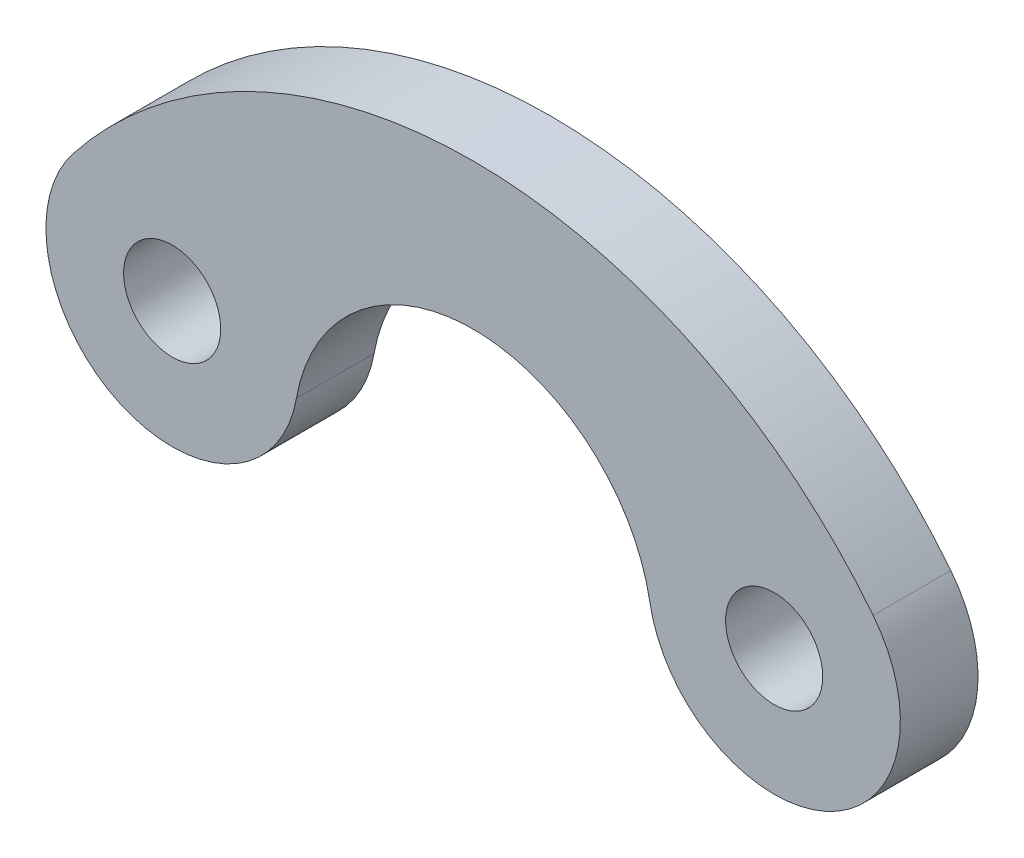
from build123d import *

# Parameters (mm, degrees)
SKETCH1_R           = 1.27
BOSS_EXTRUDE1_DEPTH = 2.032


with BuildPart() as part:
    # Sketch1 → Boss-Extrude1 (new body)
    with BuildSketch(Plane.XY):
        with BuildLine():
            ThreePointArc((-18.33725801, 2.049133221), (-17.101151717, -3.012006712), (-12.496427611, -0.574874771))
            ThreePointArc((-12.496427611, -0.574874771), (-7.874, 3.302), (-3.251572389, -0.574874771))
            ThreePointArc((-3.251572389, -0.574874771), (1.353151717, -3.012006712), (2.58925801, 2.049133221))
            ThreePointArc((2.58925801, 2.049133221), (-7.874, 7.112), (-18.33725801, 2.049133221))
        make_face()
        Circle(SKETCH1_R, mode=Mode.SUBTRACT)
        with Locations((-15.748, 0)):
            Circle(SKETCH1_R, mode=Mode.SUBTRACT)
    extrude(amount=BOSS_EXTRUDE1_DEPTH)


solid = part.part
